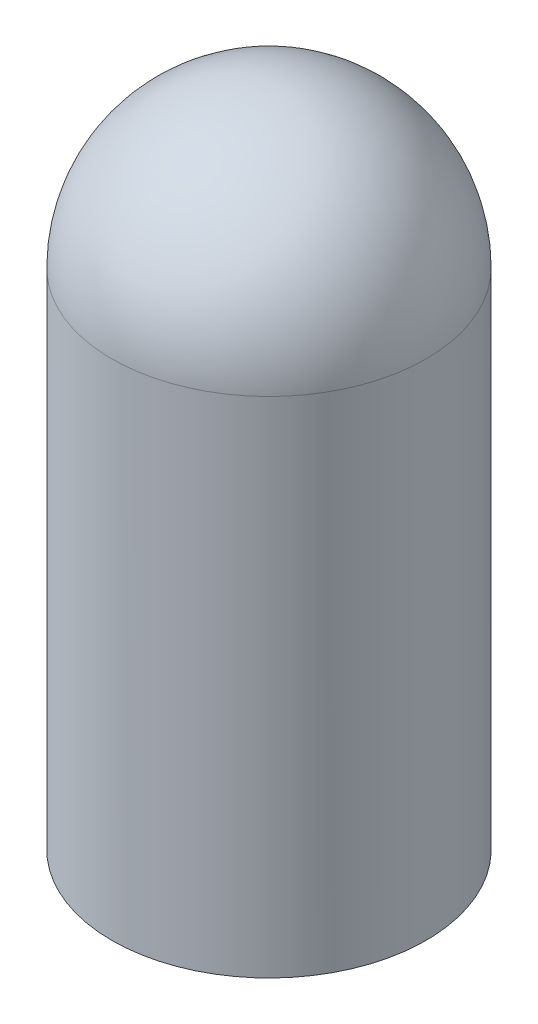
from build123d import *

# Parameters (mm, degrees)
SHELL1_T = -0.5


with BuildPart() as part:
    # Sketch2 → Revolve1 (revolve)
    with BuildSketch(Plane.XY, mode=Mode.PRIVATE) as revolve1_sk:
        with BuildLine():
            Line((9.75, 0), (9.75, 31.25))
            ThreePointArc((9.75, 31.25), (6.894291117, 38.144291117), (0, 41))
            Line((0, 41), (0, 0))
            Line((0, 0), (9.75, 0))
        make_face()
    revolve(revolve1_sk.sketch.rotate(Axis((0, 0, 0), (0, 1, 0)), 90), axis=Axis((0, 0, 0), (0, 1, 0)))

    # Shell1
    shell1_openings = [part.faces().sort_by_distance(p)[0] for p in [
        (0, 0, 0),
    ]]
    offset(amount=SHELL1_T, openings=shell1_openings, kind=Kind.INTERSECTION)


solid = part.part
